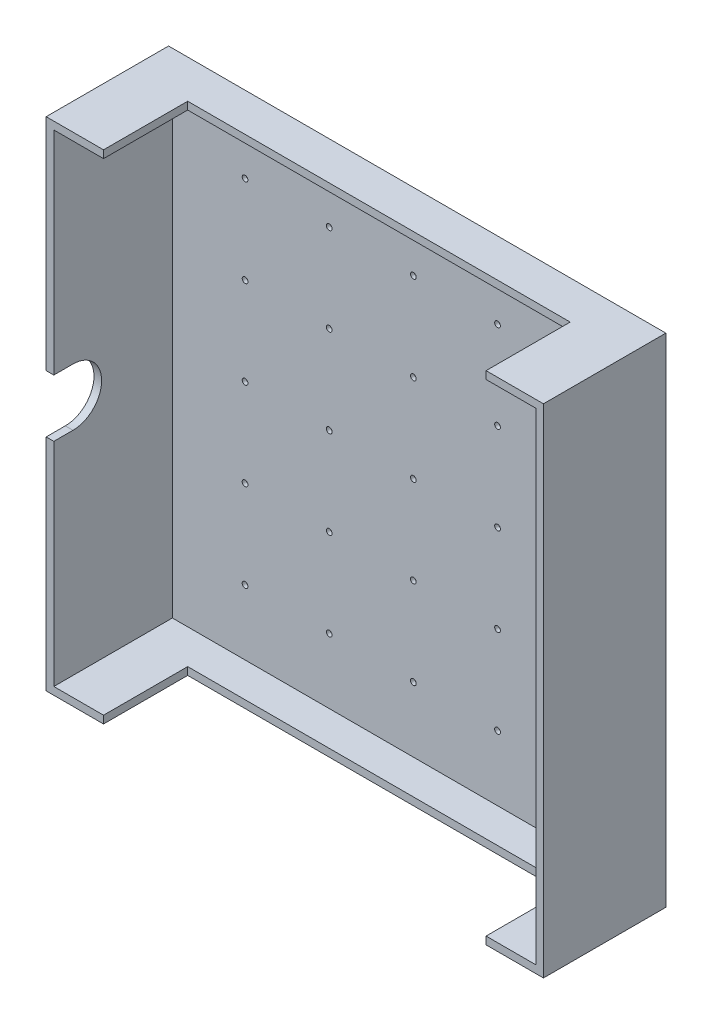
from build123d import *

# Parameters (mm, degrees)
ESQUISSE1_W             = 130
ESQUISSE1_H             = 130
BOSS_EXTRU_1_DEPTH      = 1
ESQUISSE2_W             = 130
ESQUISSE2_H             = 130
ESQUISSE2_W_2           = 126
ESQUISSE2_H_2           = 126
BOSS_EXTRU_2_DEPTH      = 31
ENL_V_MAT_EXTRU_1_DEPTH = 2
ESQUISSE6_W             = 100
ESQUISSE6_H             = 22
ENL_V_MAT_EXTRU_2_DEPTH = 187.611896727
ESQUISSE5_R             = 0.75
ENL_V_MAT_EXTRU_3_DEPTH = 1


with BuildPart() as part:
    # Esquisse1 → Boss.-Extru.1 (new body)
    with BuildSketch(Plane.XY):
        with Locations((65, 65)):
            Rectangle(ESQUISSE1_W, ESQUISSE1_H)
    extrude(amount=BOSS_EXTRU_1_DEPTH)

    # Esquisse2 → Boss.-Extru.2 (add)
    with BuildSketch(Plane.XY.offset(1)):
        with Locations((65, 65)):
            Rectangle(ESQUISSE2_W, ESQUISSE2_H)
        with Locations((65, 65)):
            Rectangle(ESQUISSE2_W_2, ESQUISSE2_H_2, mode=Mode.SUBTRACT)
    extrude(amount=BOSS_EXTRU_2_DEPTH)

    # Esquisse3 → Enlèv. mat.-Extru.1 (cut)
    with BuildSketch(Plane.ZY):
        with BuildLine():
            Line((32, 57.5), (32, 72.5))
            Line((32, 72.5), (27, 72.5))
            ThreePointArc((27, 72.5), (19.5, 65), (27, 57.5))
            Line((27, 57.5), (32, 57.5))
        make_face()
    extrude(amount=-ENL_V_MAT_EXTRU_1_DEPTH, mode=Mode.SUBTRACT)

    # Esquisse6 → Enlèv. mat.-Extru.2 (cut, through all)
    with BuildSketch(Plane(origin=(0, 130, 0), x_dir=(1, 0, 0), z_dir=(0, 1, 0))):
        with Locations((65, -21)):
            Rectangle(ESQUISSE6_W, ESQUISSE6_H)
    extrude(amount=-ENL_V_MAT_EXTRU_2_DEPTH, mode=Mode.SUBTRACT)

    # Esquisse5 → Enlèv. mat.-Extru.3 (cut)
    with BuildSketch(Plane(origin=(0, 0, 0), x_dir=(-1, 0, 0), z_dir=(0, 0, -1))):
        with Locations((-109, 111)):
            Circle(ESQUISSE5_R)
        with Locations((-87, 111)):
            Circle(ESQUISSE5_R)
        with Locations((-65, 111)):
            Circle(ESQUISSE5_R)
        with Locations((-43, 111)):
            Circle(ESQUISSE5_R)
        with Locations((-21, 111)):
            Circle(ESQUISSE5_R)
        with Locations((-109, 88)):
            Circle(ESQUISSE5_R)
        with Locations((-87, 88)):
            Circle(ESQUISSE5_R)
        with Locations((-65, 88)):
            Circle(ESQUISSE5_R)
        with Locations((-43, 88)):
            Circle(ESQUISSE5_R)
        with Locations((-21, 88)):
            Circle(ESQUISSE5_R)
        with Locations((-109, 65)):
            Circle(ESQUISSE5_R)
        with Locations((-87, 65)):
            Circle(ESQUISSE5_R)
        with Locations((-65, 65)):
            Circle(ESQUISSE5_R)
        with Locations((-43, 65)):
            Circle(ESQUISSE5_R)
        with Locations((-21, 65)):
            Circle(ESQUISSE5_R)
        with Locations((-109, 42)):
            Circle(ESQUISSE5_R)
        with Locations((-87, 42)):
            Circle(ESQUISSE5_R)
        with Locations((-65, 42)):
            Circle(ESQUISSE5_R)
        with Locations((-43, 42)):
            Circle(ESQUISSE5_R)
        with Locations((-21, 42)):
            Circle(ESQUISSE5_R)
        with Locations((-109, 19)):
            Circle(ESQUISSE5_R)
        with Locations((-87, 19)):
            Circle(ESQUISSE5_R)
        with Locations((-65, 19)):
            Circle(ESQUISSE5_R)
        with Locations((-43, 19)):
            Circle(ESQUISSE5_R)
        with Locations((-21, 19)):
            Circle(ESQUISSE5_R)
    extrude(amount=-ENL_V_MAT_EXTRU_3_DEPTH, mode=Mode.SUBTRACT)


solid = part.part
